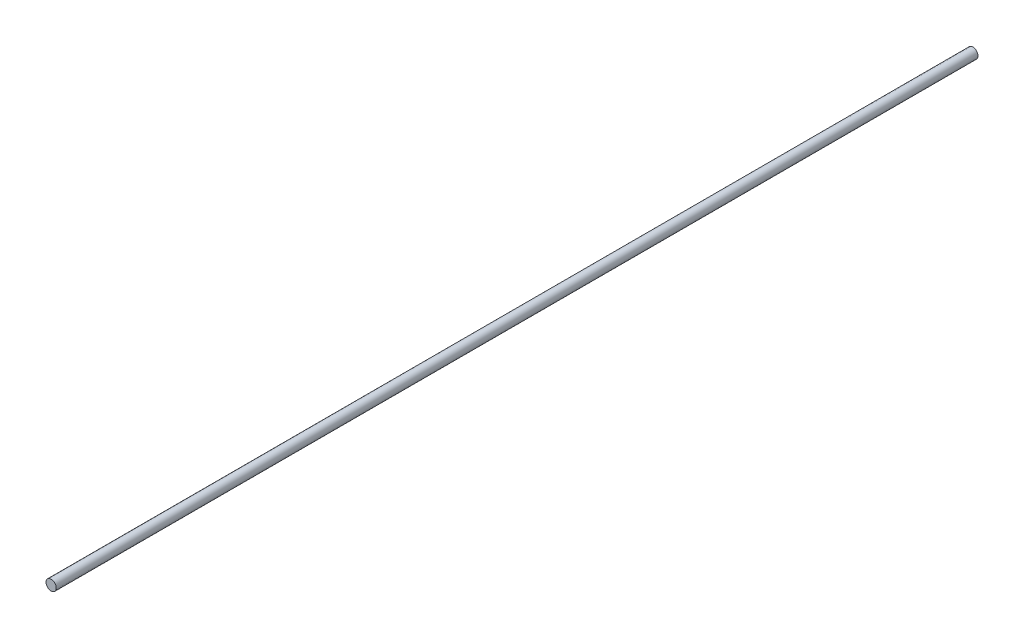
from build123d import *

# Parameters (mm, degrees)
SKETCH1_R           = 1
BOSS_EXTRUDE1_DEPTH = 180


with BuildPart() as part:
    # Sketch1 → Boss-Extrude1 (new body)
    with BuildSketch(Plane.XY):
        with Locations(Location((0, 0, 0), (0, 0, 180))):
            Circle(SKETCH1_R)
    extrude(amount=BOSS_EXTRUDE1_DEPTH)


solid = part.part
